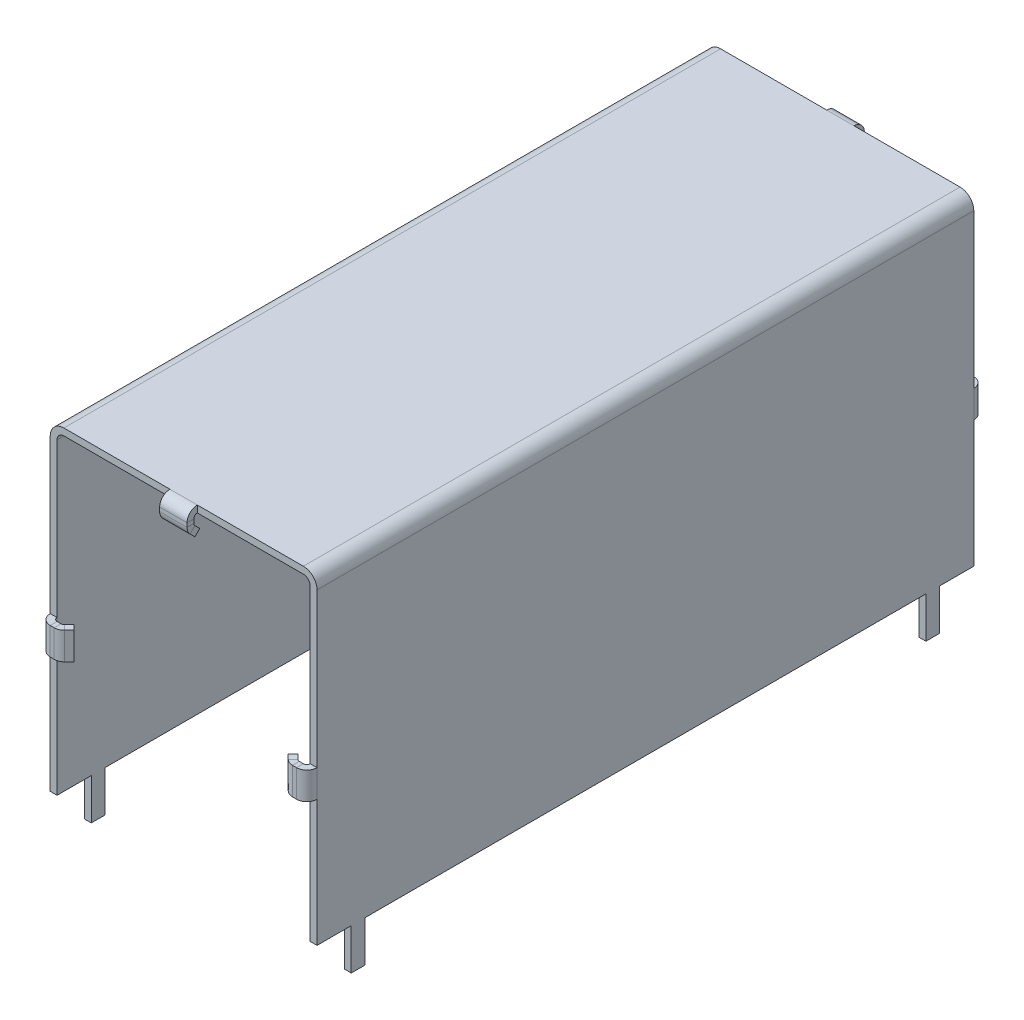
from build123d import *

# Parameters (mm, degrees)
EXTRUDE_1_DEPTH     = 48
SKETCH_3_W          = 2
SKETCH_3_H          = 3.503465233
EXTRUDE_2_DEPTH     = 0.5
SKETCH_4_W          = 2
SKETCH_4_H          = 3.503465233
EXTRUDE_3_DEPTH     = 0.5
SKETCH_7_W          = 0.5
SKETCH_7_H          = 3.503465233
CUT_EXTRUDE_2_DEPTH = 66.5
SKETCH_10_W         = 2
SKETCH_10_H         = 0.5
CUT_EXTRUDE_3_DEPTH = 66.5
SKETCH_13_W         = 0.5
SKETCH_13_H         = 2
SKETCH_16_W         = 0.5
SKETCH_16_H         = 2


with BuildPart() as part:
    # Эскиз1 → Бобышка-Вытянуть1 (new body)
    with BuildSketch(Plane.XY):
        with BuildLine():
            Line((0.5, 0), (0.5, 25.5))
            ThreePointArc((0.5, 25.5), (0.646446609, 25.853553391), (1, 26))
            Line((1, 26), (18.5, 26))
            ThreePointArc((18.5, 26), (18.853553391, 25.853553391), (19, 25.5))
            Line((19, 25.5), (19, 0))
            Line((19, 0), (19.5, 0))
            Line((19.5, 0), (19.5, 25.5))
            ThreePointArc((19.5, 25.5), (19.207106781, 26.207106781), (18.5, 26.5))
            Line((18.5, 26.5), (1, 26.5))
            ThreePointArc((1, 26.5), (0.292893219, 26.207106781), (0, 25.5))
            Line((0, 25.5), (0, 0))
            Line((0, 0), (0.5, 0))
        make_face()
    extrude(amount=EXTRUDE_1_DEPTH)

    # Эскиз3 → Бобышка-Вытянуть2 (add)
    with BuildSketch(Plane.ZY):
        with Locations((45, -1.751732617)):
            Rectangle(SKETCH_3_W, SKETCH_3_H)
        with Locations((3, -1.751732617)):
            Rectangle(SKETCH_3_W, SKETCH_3_H)
    extrude(amount=-EXTRUDE_2_DEPTH)

    # Эскиз4 → Бобышка-Вытянуть3 (add)
    with BuildSketch(Plane(origin=(19.5, 0, 0), x_dir=(0, 0, -1), z_dir=(1, 0, 0))):
        with Locations((-45, -1.751732617)):
            Rectangle(SKETCH_4_W, SKETCH_4_H)
        with Locations((-3, -1.751732617)):
            Rectangle(SKETCH_4_W, SKETCH_4_H)
    extrude(amount=-EXTRUDE_3_DEPTH)

    # Эскиз7 → Вырез-Вытянуть2 (cut)
    with BuildSketch(Plane.ZY):
        with Locations((45.75, -1.751732617)):
            Rectangle(SKETCH_7_W, SKETCH_7_H)
        with Locations((3.75, -1.751732617)):
            Rectangle(SKETCH_7_W, SKETCH_7_H)
        with Locations((44.25, -1.751732617)):
            Rectangle(SKETCH_7_W, SKETCH_7_H)
        with Locations((2.25, -1.751732617)):
            Rectangle(SKETCH_7_W, SKETCH_7_H)
    extrude(amount=-CUT_EXTRUDE_2_DEPTH, mode=Mode.SUBTRACT)

    # По траектории2: sweep along a path in Эскиз9
    with BuildLine(Plane.ZY) as sweep_2_path:
        Line((48, 24.75), (48.353553391, 25.103553391))
        ThreePointArc((48.353553391, 25.103553391), (48.461939766, 25.265765065), (48.5, 25.457106781))
        Line((48.5, 25.457106781), (48.5, 25.75))
        ThreePointArc((48.5, 25.75), (48.353553391, 26.103553391), (48, 26.25))
        Line((48, 26.25), (0, 26.25))
        ThreePointArc((0, 26.25), (-0.353553391, 26.103553391), (-0.5, 25.75))
        Line((-0.5, 25.75), (-0.5, 25.457106781))
        ThreePointArc((-0.5, 25.457106781), (-0.461939766, 25.265765065), (-0.353553391, 25.103553391))
        Line((-0.353553391, 25.103553391), (0, 24.75))
    # Эскиз10 → По траектории2 (sweep)
    with BuildSketch(Plane(origin=(0, 24.75, 48), x_dir=(1, 0, 0), z_dir=(0, 0.7071067811865477, 0.7071067811865475))):
        with Locations((9.75, 0)):
            Rectangle(SKETCH_10_W, SKETCH_10_H)
    sweep(path=sweep_2_path.line)

    # Эскиз14 → Вырез-Вытянуть3 (cut)
    with BuildSketch(Plane.ZY):
        Polygon((2.5, 0), (3.5, 0), (3.5, 3), (44.5, 3), (44.5, 0), (45.5, 0), (45.5, 3), (48, 3), (48, 0), (46.949999013, 0), (46.949999013, -4.072410454), (1.67699977, -4.072410454), (1.67699977, 0), (0, 0), (0, 3), (2.5, 3), align=None)
    extrude(amount=-CUT_EXTRUDE_3_DEPTH, mode=Mode.SUBTRACT)

    # По траектории3: sweep along a path in Эскиз11
    with BuildLine(Plane(origin=(0, 26.5, 0), x_dir=(1, 0, 0), z_dir=(0, 1, 0))) as sweep_3_path:
        Line((17.75, 0), (18.103553391, 0.353553391))
        ThreePointArc((18.103553391, 0.353553391), (18.265765065, 0.461939766), (18.457106781, 0.5))
        Line((18.457106781, 0.5), (18.75, 0.5))
        ThreePointArc((18.75, 0.5), (19.103553391, 0.353553391), (19.25, 0))
        Line((19.25, 0), (19.25, -48))
        ThreePointArc((19.25, -48), (19.103553391, -48.353553391), (18.75, -48.5))
        Line((18.75, -48.5), (18.457106781, -48.5))
        ThreePointArc((18.457106781, -48.5), (18.265765065, -48.461939766), (18.103553391, -48.353553391))
        Line((18.103553391, -48.353553391), (17.75, -48))
    # Эскиз13 → По траектории3 (sweep)
    with BuildSketch(Plane(origin=(17.75, 26.5, 0), x_dir=(0.7071067811865498, 0, 0.7071067811865454), z_dir=(-0.7071067811865454, 0, 0.7071067811865498))):
        with Locations((0, -13.25)):
            Rectangle(SKETCH_13_W, SKETCH_13_H)
    sweep(path=sweep_3_path.line)

    # По траектории4: sweep along a path in Эскиз15
    with BuildLine(Plane(origin=(0, 26.5, 0), x_dir=(1, 0, 0), z_dir=(0, 1, 0))) as sweep_4_path:
        Line((1.75, 0), (1.396446609, 0.353553391))
        ThreePointArc((1.396446609, 0.353553391), (1.234234935, 0.461939766), (1.042893219, 0.5))
        Line((1.042893219, 0.5), (0.75, 0.5))
        ThreePointArc((0.75, 0.5), (0.396446609, 0.353553391), (0.25, 0))
        Line((0.25, 0), (0.25, -48))
        ThreePointArc((0.25, -48), (0.396446609, -48.353553391), (0.75, -48.5))
        Line((0.75, -48.5), (1.042893219, -48.5))
        ThreePointArc((1.042893219, -48.5), (1.234234935, -48.461939766), (1.396446609, -48.353553391))
        Line((1.396446609, -48.353553391), (1.75, -48))
    # Эскиз16 → По траектории4 (sweep)
    with BuildSketch(Plane(origin=(1.75, 26.5, 48), x_dir=(-0.7071067811865488, 0, -0.7071067811865464), z_dir=(0.7071067811865464, 0, -0.7071067811865488))):
        with Locations((0, -13.25)):
            Rectangle(SKETCH_16_W, SKETCH_16_H)
    sweep(path=sweep_4_path.line)


solid = part.part
